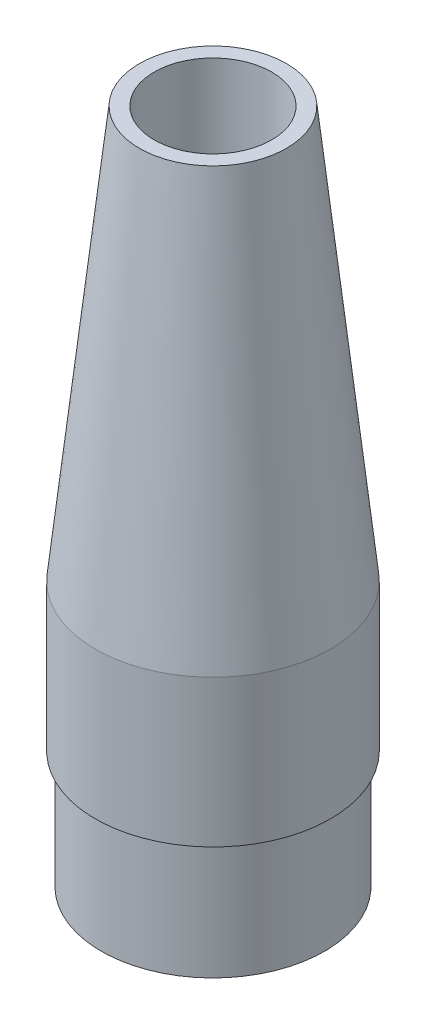
from build123d import *


with BuildPart() as part:
    # 스케치1 → 회전1 (revolve)
    with BuildSketch(Plane.XY, mode=Mode.PRIVATE) as revolve_1_sk:
        Polygon((10, 0), (19, 0), (19, 20), (20, 20), (20, 45), (12.5, 115), (10, 115), (10, 85), (5, 85), (5, 80), (7.782730507, 80), (7.782730507, 75.813819554), (10, 70.553192673), align=None)
    revolve(revolve_1_sk.sketch.rotate(Axis((0, 0, 0), (0, 1, 0)), 90), axis=Axis((0, 0, 0), (0, 1, 0)))


solid = part.part
